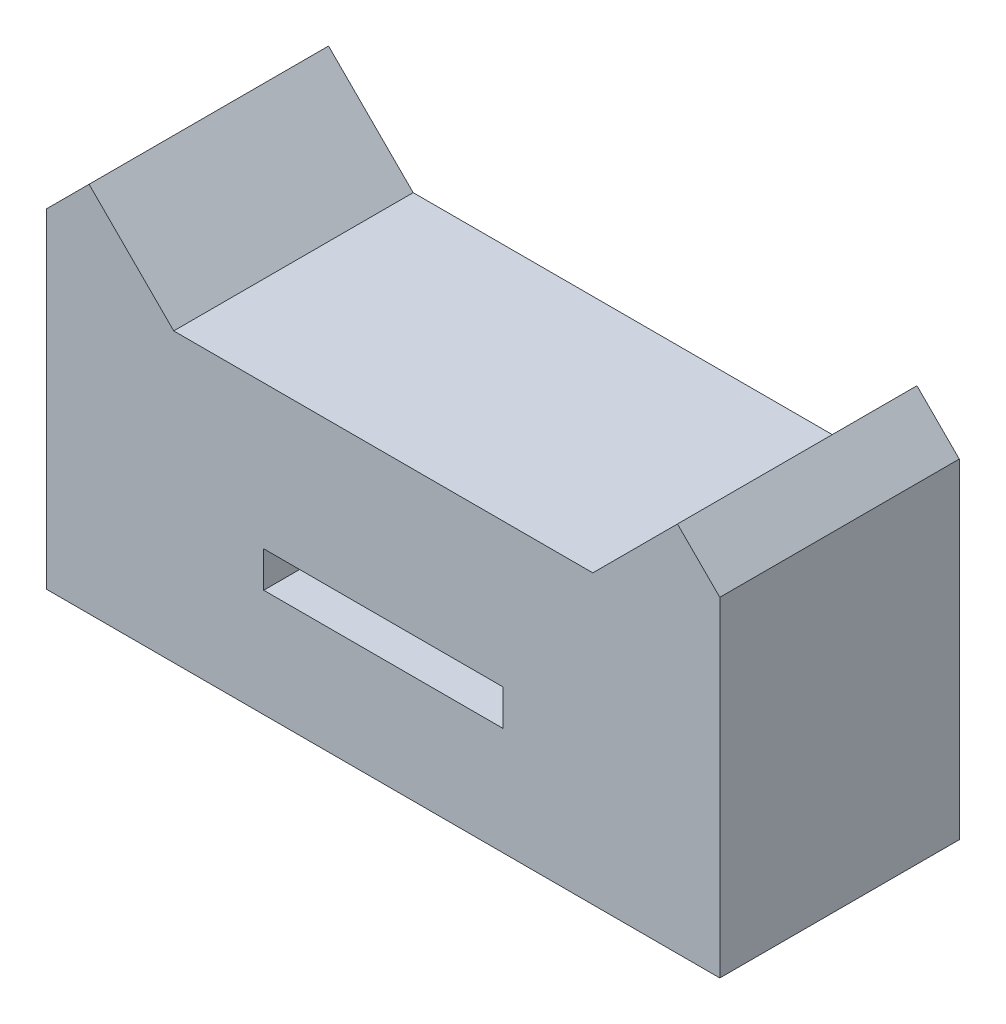
from build123d import *

# Parameters (mm, degrees)
BOSS_EXTRUDE1_DEPTH      = 10
BOSS_EXTRUDE1_DEPTH_BACK = 10
SKETCH3_W                = 19.984775587
SKETCH3_H                = 3
CUT_EXTRUDE1_DEPTH       = 10
BODY_MOVE_COPY1_ANGLE    = 180


with BuildPart() as part:
    # Sketch2 → Boss-Extrude1 (new, two sides: drawn at the far end of the back side and taken through both)
    with BuildSketch(Plane.XY.offset(-BOSS_EXTRUDE1_DEPTH_BACK)):
        Polygon((28.106601718, -45), (28.106601718, -17.464466094), (24.571067812, -13.928932188), (17.5, -21), (-17.5, -21), (-24.571067812, -13.928932188), (-28.106601718, -17.464466094), (-28.106601718, -45), align=None)
    extrude(amount=BOSS_EXTRUDE1_DEPTH + BOSS_EXTRUDE1_DEPTH_BACK)

    # Sketch3 → Cut-Extrude1 (cut)
    with BuildSketch(Plane(origin=(0, 0, -10), x_dir=(-1, 0, 0), z_dir=(0, 0, -1))):
        with Locations((0.007612206, -34.5)):
            Rectangle(SKETCH3_W, SKETCH3_H)
    extrude(amount=-CUT_EXTRUDE1_DEPTH, mode=Mode.SUBTRACT)


with BuildPart() as part_1:
    # Body-Move/Copy1: moved
    add(part.part.rotate(Axis((0, 0, 0), (0, 1, 0)), BODY_MOVE_COPY1_ANGLE))


solid = part_1.part
